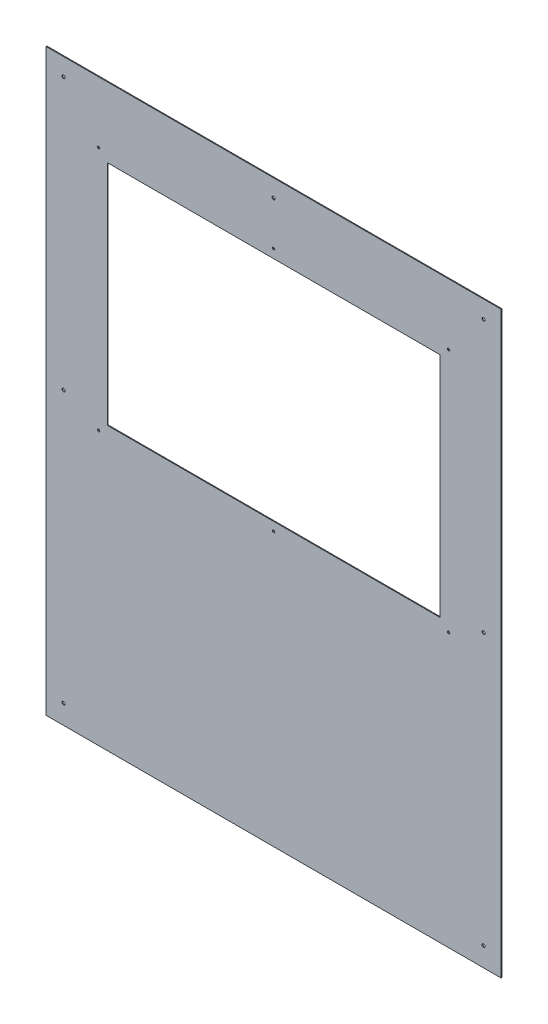
from build123d import *

# Parameters (mm, degrees)
SKETCH1_W                     = 660.4
SKETCH1_H                     = 840.74
BOSS_EXTRUDE1_DEPTH           = 1.2192
F_8_CLEARANCE_HOLE1_D         = 4.4958
SKETCH5_W                     = 482.6
SKETCH5_H                     = 330.2
CUT_EXTRUDE1_DEPTH            = 2.54
TAP_DRILL_FOR_8_32_TAP1_D     = 3.4544
TAP_DRILL_FOR_8_32_TAP1_DEPTH = 25.4
TAP_DRILL_FOR_8_32_TAP1_TIP   = 1.037806461


with BuildPart() as part:
    # Sketch1 → Boss-Extrude1 (new body)
    with BuildSketch(Plane.XY):
        with Locations((330.2, 420.37)):
            Rectangle(SKETCH1_W, SKETCH1_H)
    extrude(amount=BOSS_EXTRUDE1_DEPTH)

    # #8 Clearance Hole1 (through all)
    with Locations(Plane.XY.offset(1.2192)):
        with Locations((25.4, 815.34), (330.2, 815.34), (635, 815.34), (25.4, 421.64), (25.4, 27.94), (635, 27.94), (635, 421.64)):
            Hole(F_8_CLEARANCE_HOLE1_D / 2)

    # Sketch5 → Cut-Extrude1 (cut)
    with BuildSketch(Plane.XY.offset(1.2192)):
        with Locations((330.2, 574.04)):
            Rectangle(SKETCH5_W, SKETCH5_H)
    extrude(amount=-CUT_EXTRUDE1_DEPTH, mode=Mode.SUBTRACT)

    # Tap Drill for #8-32 Tap1
    with Locations(Plane.XY.offset(1.2192)):
        with Locations((76.2, 751.84), (330.2, 751.84), (584.2, 751.84), (584.2, 396.24), (330.2, 396.24), (76.2, 396.24)):
            Hole(TAP_DRILL_FOR_8_32_TAP1_D / 2, depth=TAP_DRILL_FOR_8_32_TAP1_DEPTH)
            with Locations((0, 0, -(TAP_DRILL_FOR_8_32_TAP1_DEPTH + TAP_DRILL_FOR_8_32_TAP1_TIP / 2))):  # 118° drill point
                Cone(0, TAP_DRILL_FOR_8_32_TAP1_D / 2, TAP_DRILL_FOR_8_32_TAP1_TIP, mode=Mode.SUBTRACT)


solid = part.part
